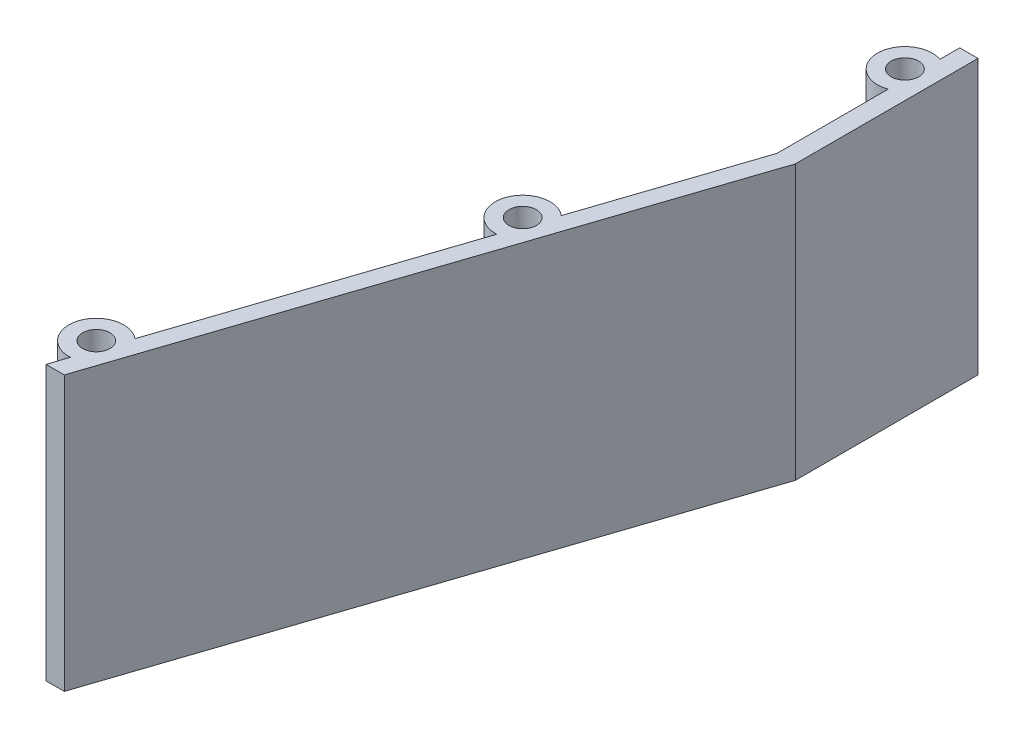
from build123d import *

# Parameters (mm, degrees)
SKETCH_1_R      = 1.5
EXTRUDE_1_DEPTH = 30


with BuildPart() as part:
    # 草图1 → 凸台-拉伸1 (new body)
    with BuildSketch(Plane(origin=(0, 0, 0), x_dir=(1, 0, 0), z_dir=(0, 1, 0))):
        with BuildLine():
            Line((0, 0), (-5.900613322, -17.701839967))
            ThreePointArc((-5.900613322, -17.701839967), (-10.674994221, -19.051316702), (-7.665175543, -22.995526629))
            Line((-7.665175543, -22.995526629), (-17.567279989, -52.701839967))
            ThreePointArc((-17.567279989, -52.701839967), (-22.341660888, -54.051316702), (-19.33184221, -57.995526629))
            Line((-19.33184221, -57.995526629), (-20, -60))
            Line((-20, -60), (-18, -60))
            Line((-18, -60), (2, 0))
            Line((2, 0), (2, 20))
            Line((2, 20), (0, 20))
            Line((0, 20), (0, 17.828427125))
            ThreePointArc((0, 17.828427125), (-4, 15), (0, 12.171572875))
            Line((0, 12.171572875), (0, 0))
        make_face()
        with Locations(Location((-7.828944327, -20, 0), (0, 0, 270))):
            Circle(SKETCH_1_R, mode=Mode.SUBTRACT)
        with Locations(Location((-1, 15, 0), (0, 0, 270))):
            Circle(SKETCH_1_R, mode=Mode.SUBTRACT)
        with Locations(Location((-19.495610994, -55, 0), (0, 0, 270))):
            Circle(SKETCH_1_R, mode=Mode.SUBTRACT)
    extrude(amount=EXTRUDE_1_DEPTH)


solid = part.part
